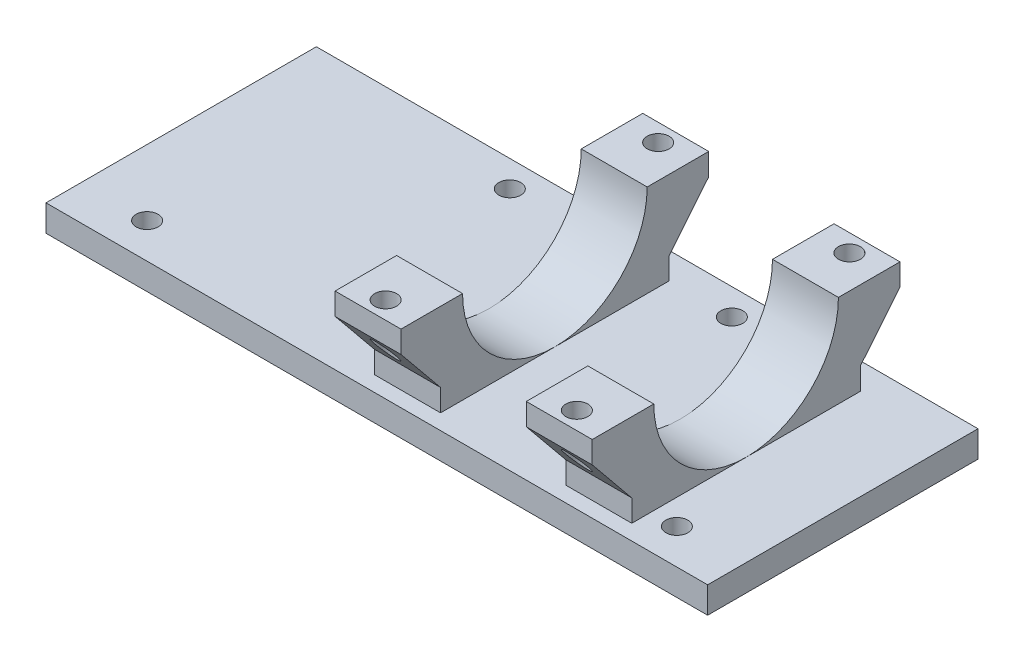
from build123d import *

# Parameters (mm, degrees)
CROQUIS1_W                = 149
CROQUIS1_H                = 53
SALIENTE_EXTRUIR1_DEPTH   = 6
SALIENTE_EXTRUIR2_DEPTH   = 15
SALIENTE_EXTRUIR5_DEPTH   = 15
CROQUIS3_R                = 21
CORTAR_EXTRUIR2_DEPTH     = 140.238105417
CROQUIS10_W               = 149
CROQUIS10_H               = 6
SALIENTE_EXTRUIR23_DEPTH  = 3
CROQUIS11_W               = 2.25
CROQUIS11_H               = 56
CORTAR_EXTRUIR3_DEPTH     = 93.895102131
CROQUIS12_W               = 56
CROQUIS12_H               = 6
SALIENTE_EXTRUIR24_DEPTH  = 3.75
CROQUIS13_W               = 150.5
CROQUIS13_H               = 0.5
CORTAR_EXTRUIR4_DEPTH     = 96.928684448
CROQUIS14_W               = 169.427236994
CROQUIS14_H               = 76.033419256
CORTAR_EXTRUIR5_DEPTH     = 88.876689173
SALIENTE_EXTRUIR25_DEPTH  = 15
CROQUIS16_R               = 2.5
CORTAR_EXTRUIR6_DEPTH     = 15
SIMETR_A2_COPY_1_DEPTH    = 15
SIMETR_A2_COPY_2_SKETCH_R = 2.5
SIMETR_A2_COPY_2_DEPTH    = 15
CROQUIS17_R               = 2.5
CORTAR_EXTRUIR7_DEPTH     = 89.255665541
CROQUIS19_W               = 150.5
CROQUIS19_H               = 6
SALIENTE_EXTRUIR26_DEPTH  = 6
CROQUIS20_R               = 2.5
CORTAR_EXTRUIR8_DEPTH     = 89.255665541


with BuildPart() as part:
    # Croquis1 → Saliente-Extruir1 (new body)
    with BuildSketch(Plane(origin=(0, 0, 0), x_dir=(1, 0, 0), z_dir=(0, 1, 0))):
        Rectangle(CROQUIS1_W, CROQUIS1_H)
    extrude(amount=SALIENTE_EXTRUIR1_DEPTH)

    # Croquis2 → Saliente-Extruir2 (add)
    with BuildSketch(Plane(origin=(51.5, 0, 0), x_dir=(0, 0, -1), z_dir=(1, 0, 0))):
        with BuildLine():
            Line((26, 6), (-26, 6))
            Line((-26, 6), (-26, 27))
            ThreePointArc((-26, 27), (0, 53), (26, 27))
            Line((26, 27), (26, 6))
        make_face()
    extrude(amount=-SALIENTE_EXTRUIR2_DEPTH)

    # Croquis5 → Saliente-Extruir5 (add)
    with BuildSketch(Plane.ZY.offset(-8)):
        with BuildLine():
            Line((-26, 6), (26, 6))
            Line((26, 6), (26, 27))
            ThreePointArc((26, 27), (0, 53), (-26, 27))
            Line((-26, 27), (-26, 6))
        make_face()
    extrude(amount=SALIENTE_EXTRUIR5_DEPTH)

    # Croquis3 → Cortar-Extruir2 (cut, through all)
    with BuildSketch(Plane(origin=(51.5, 0, 0), x_dir=(0, 0, -1), z_dir=(1, 0, 0))):
        with Locations(Location((0, 27, 0), (0, 0, 270))):
            Circle(CROQUIS3_R)
    extrude(amount=-CORTAR_EXTRUIR2_DEPTH, mode=Mode.SUBTRACT)

    # Croquis10 → Saliente-Extruir23 (add)
    with BuildSketch(Plane.XY.offset(26.5)):
        with Locations((0, 3)):
            Rectangle(CROQUIS10_W, CROQUIS10_H)
    extrude(amount=SALIENTE_EXTRUIR23_DEPTH)

    # Croquis11 → Cortar-Extruir3 (cut, through all)
    with BuildSketch(Plane(origin=(0, 6, 0), x_dir=(1, 0, 0), z_dir=(0, 1, 0))):
        with Locations((73.375, -1.5)):
            Rectangle(CROQUIS11_W, CROQUIS11_H)
    extrude(amount=-CORTAR_EXTRUIR3_DEPTH, mode=Mode.SUBTRACT)

    # Croquis12 → Saliente-Extruir24 (add)
    with BuildSketch(Plane.ZY.offset(74.5)):
        with Locations((1.5, 3)):
            Rectangle(CROQUIS12_W, CROQUIS12_H)
    extrude(amount=SALIENTE_EXTRUIR24_DEPTH)

    # Croquis13 → Cortar-Extruir4 (cut, through all)
    with BuildSketch(Plane(origin=(0, 6, 0), x_dir=(1, 0, 0), z_dir=(0, 1, 0))):
        with Locations((-3, 26.25)):
            Rectangle(CROQUIS13_W, CROQUIS13_H)
    extrude(amount=-CORTAR_EXTRUIR4_DEPTH, mode=Mode.SUBTRACT)

    # Croquis14 → Cortar-Extruir5 (cut, through all)
    with BuildSketch(Plane(origin=(0, 27, 0), x_dir=(-1, 0, 0), z_dir=(0, -1, 0))):
        Rectangle(CROQUIS14_W, CROQUIS14_H)
    extrude(amount=-CORTAR_EXTRUIR5_DEPTH, mode=Mode.SUBTRACT)

    # Croquis15 → Saliente-Extruir25 (add)
    with BuildSketch(Plane(origin=(51.5, 0, 0), x_dir=(0, 0, -1), z_dir=(1, 0, 0))):
        Polygon((-26, 27), (-35, 27), (-35, 22), (-26, 11), align=None)
    saliente_extruir25 = extrude(amount=-SALIENTE_EXTRUIR25_DEPTH)

    # Croquis16 → Cortar-Extruir6 (cut)
    with BuildSketch(Plane(origin=(0, 27, 0), x_dir=(1, 0, 0), z_dir=(0, 1, 0))):
        with Locations(Location((44, -31, 0), (0, 0, 270))):
            Circle(CROQUIS16_R)
    cortar_extruir6 = extrude(amount=-CORTAR_EXTRUIR6_DEPTH, mode=Mode.SUBTRACT)

    # Simetría1: Saliente-Extruir25, Cortar-Extruir6 across plane
    add(saliente_extruir25.mirror(Plane.ZY.offset(-22.25)))
    add(cortar_extruir6.mirror(Plane.ZY.offset(-22.25)), mode=Mode.SUBTRACT)

    # Simetría2: Saliente-Extruir25, Cortar-Extruir6 across plane
    add(saliente_extruir25.mirror(Plane.XY))
    add(cortar_extruir6.mirror(Plane.XY), mode=Mode.SUBTRACT)

    # Simetría2 copy 1 sketch → Simetría2 copy 1 (add)
    with BuildSketch(Plane.ZY.offset(7)):
        Polygon((-26, 27), (-35, 27), (-35, 22), (-26, 11), align=None)
    extrude(amount=-SIMETR_A2_COPY_1_DEPTH)

    # Simetría2 copy 2 sketch → Simetría2 copy 2 (cut)
    with BuildSketch(Plane(origin=(44.5, 27, 0), x_dir=(-1, 0, 0), z_dir=(0, 1, 0))):
        with Locations(Location((44, -31, 0), (0, 0, 270))):
            Circle(SIMETR_A2_COPY_2_SKETCH_R)
    extrude(amount=-SIMETR_A2_COPY_2_DEPTH, mode=Mode.SUBTRACT)

    # Croquis17 → Cortar-Extruir7 (cut, through all)
    with BuildSketch(Plane(origin=(0, 6, 0), x_dir=(1, 0, 0), z_dir=(0, 1, 0))):
        with Locations(Location((-63.25, -21.5, 0), (0, 0, 270))):
            Circle(CROQUIS17_R)
    cortar_extruir7 = extrude(amount=-CORTAR_EXTRUIR7_DEPTH, mode=Mode.SUBTRACT)

    # Croquis19 → Saliente-Extruir26 (add)
    with BuildSketch(Plane(origin=(0, 0, -26), x_dir=(-1, 0, 0), z_dir=(0, 0, -1))):
        with Locations((3, 3)):
            Rectangle(CROQUIS19_W, CROQUIS19_H)
    extrude(amount=SALIENTE_EXTRUIR26_DEPTH)

    # Simetría5: Cortar-Extruir7 across plane
    add(cortar_extruir7.mirror(Plane(origin=(-3, 0, 0), x_dir=(0, 0, 1), z_dir=(1, 0, 0))), mode=Mode.SUBTRACT)

    # Croquis20 → Cortar-Extruir8 (cut, through all)
    with BuildSketch(Plane(origin=(0, 6, 0), x_dir=(1, 0, 0), z_dir=(0, 1, 0))):
        with Locations(Location((22.25, 26, 0), (0, 0, 270))):
            Circle(CROQUIS20_R)
    cortar_extruir8 = extrude(amount=-CORTAR_EXTRUIR8_DEPTH, mode=Mode.SUBTRACT)

    # Simetría6: Cortar-Extruir8 across plane
    add(cortar_extruir8.mirror(Plane(origin=(-3, 0, 0), x_dir=(0, 0, 1), z_dir=(1, 0, 0))), mode=Mode.SUBTRACT)


solid = part.part
